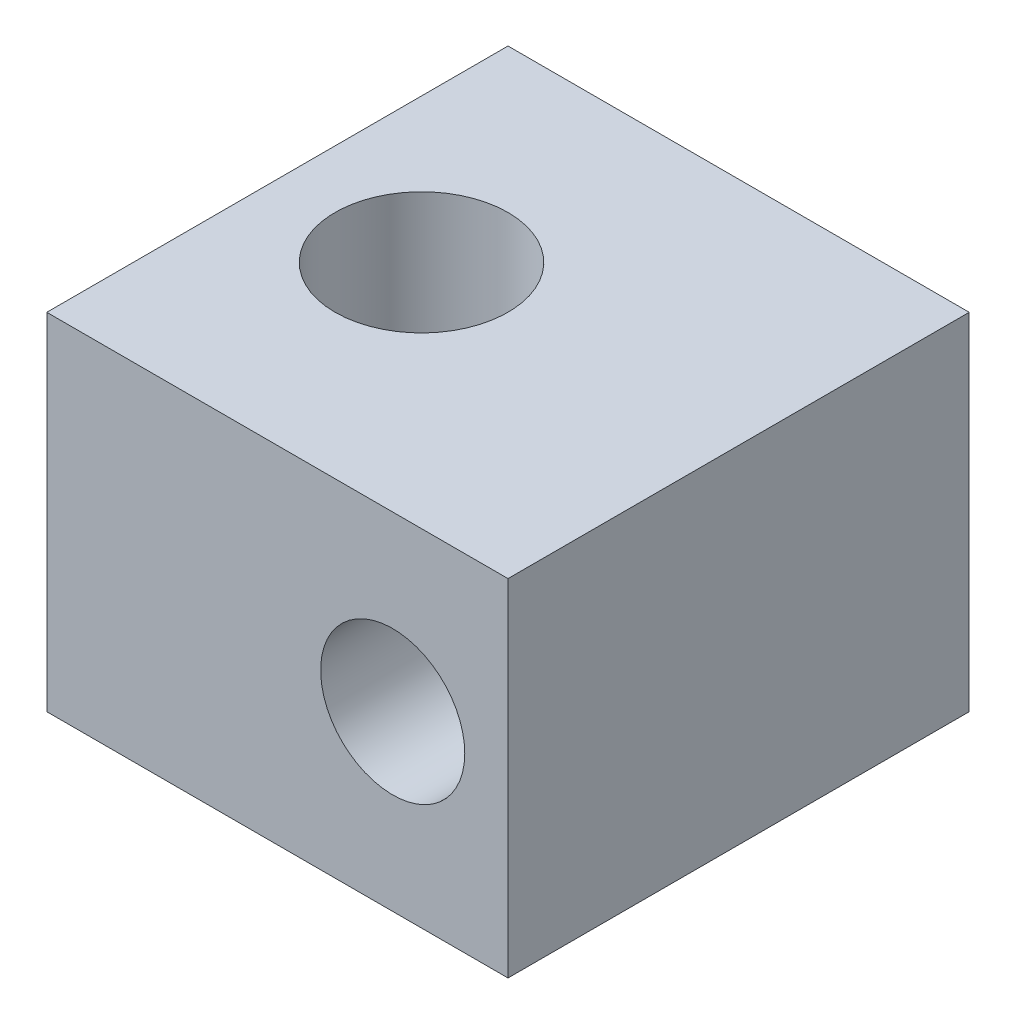
from build123d import *

# Parameters (mm, degrees)
SKICA1_W                 = 16
SKICA1_H                 = 16
SKICA1_R                 = 3
P_IDAT_VYSUNUT_M1_DEPTH  = 12
SKICA2_R                 = 2.5
ODEBRAT_VYSUNUT_M1_DEPTH = 22


with BuildPart() as part:
    # Skica1 → Přidat vysunutím1 (new body)
    with BuildSketch(Plane(origin=(0, 0, 0), x_dir=(1, 0, 0), z_dir=(0, 1, 0))):
        Rectangle(SKICA1_W, SKICA1_H)
        with Locations(Location((-3, 0, 0), (0, 0, 270))):
            Circle(SKICA1_R, mode=Mode.SUBTRACT)
    extrude(amount=P_IDAT_VYSUNUT_M1_DEPTH)

    # Skica2 → Odebrat vysunutím1 (cut)
    with BuildSketch(Plane.XY.offset(8)):
        with Locations((4, 6)):
            Circle(SKICA2_R)
    extrude(amount=-ODEBRAT_VYSUNUT_M1_DEPTH, mode=Mode.SUBTRACT)


solid = part.part
